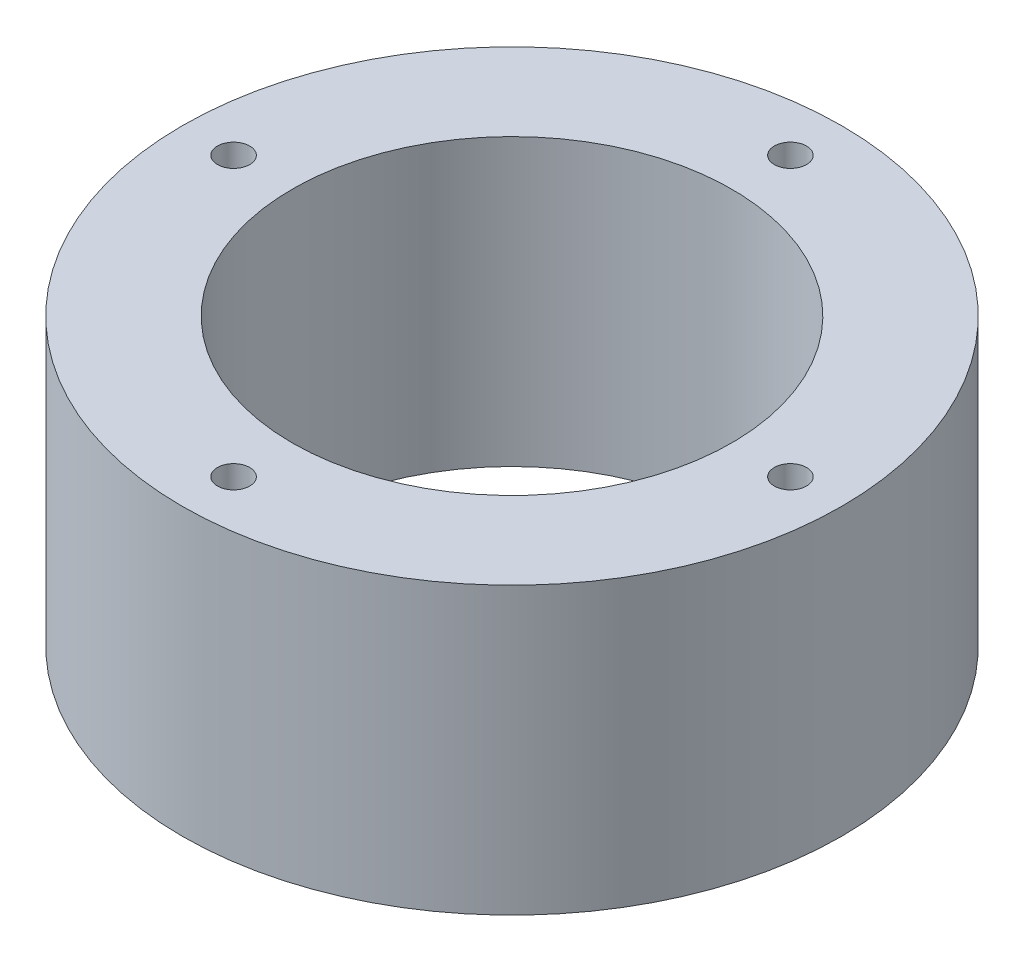
from build123d import *

# Parameters (mm, degrees)
SKETCH_1_R      = 22.5
SKETCH_1_R_2    = 15
SKETCH_1_R_3    = 1.1
EXTRUDE_1_DEPTH = 19.5


with BuildPart() as part:
    # 草图1 → 凸台-拉伸1 (new body)
    with BuildSketch(Plane(origin=(0, 0, 0), x_dir=(1, 0, 0), z_dir=(0, 1, 0))):
        with Locations(Location((0, 0, 0), (0, 0, 270))):
            Circle(SKETCH_1_R)
        with Locations(Location((0, 0, 0), (0, 0, 270))):
            Circle(SKETCH_1_R_2, mode=Mode.SUBTRACT)
        with Locations(Location((0, 19, 0), (0, 0, 270))):
            Circle(SKETCH_1_R_3, mode=Mode.SUBTRACT)
        with Locations(Location((19, 0, 0), (0, 0, 270))):
            Circle(SKETCH_1_R_3, mode=Mode.SUBTRACT)
        with Locations(Location((0, -19, 0), (0, 0, 270))):
            Circle(SKETCH_1_R_3, mode=Mode.SUBTRACT)
        with Locations(Location((-19, 0, 0), (0, 0, 270))):
            Circle(SKETCH_1_R_3, mode=Mode.SUBTRACT)
    extrude(amount=EXTRUDE_1_DEPTH)


solid = part.part
